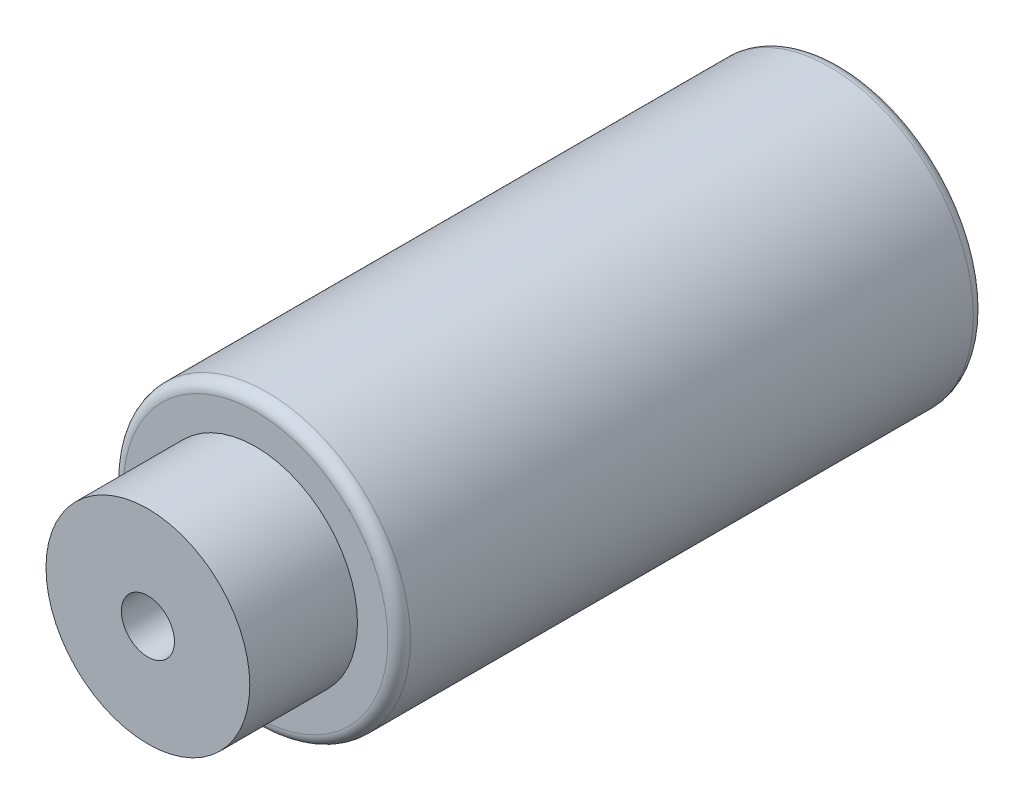
from build123d import *

# Parameters (mm, degrees)
SKETCH1_R           = 12.7
BOSS_EXTRUDE1_DEPTH = 51.816
FILLET1_R           = 1
SKETCH2_R           = 9.017
BOSS_EXTRUDE3_DEPTH = 9.53
SKETCH5_R           = 5.4991
CUT_EXTRUDE1_DEPTH  = 50.8
SKETCH6_R           = 2.3495
CUT_EXTRUDE2_DEPTH  = 50.8


with BuildPart() as part:
    # Sketch1 → Boss-Extrude1 (new body)
    with BuildSketch(Plane.XY):
        Circle(SKETCH1_R)
    extrude(amount=BOSS_EXTRUDE1_DEPTH)

    # Fillet1
    fillet1_edges = [part.edges().sort_by_distance(p)[0] for p in [
        (-12.7, 0, 0),
        (-12.7, 0, 51.816),
    ]]
    fillet(fillet1_edges, radius=FILLET1_R)

    # Sketch2 → Boss-Extrude3 (add)
    with BuildSketch(Plane.XY.offset(51.816)):
        Circle(SKETCH2_R)
    extrude(amount=BOSS_EXTRUDE3_DEPTH)

    # Sketch5 → Cut-Extrude1 (cut)
    with BuildSketch(Plane(origin=(0, 0, 0), x_dir=(-1, 0, 0), z_dir=(0, 0, -1))):
        Circle(SKETCH5_R)
    extrude(amount=-CUT_EXTRUDE1_DEPTH, mode=Mode.SUBTRACT)

    # Sketch6 → Cut-Extrude2 (cut)
    with BuildSketch(Plane.XY.offset(61.346)):
        Circle(SKETCH6_R)
    extrude(amount=-CUT_EXTRUDE2_DEPTH, mode=Mode.SUBTRACT)


solid = part.part
